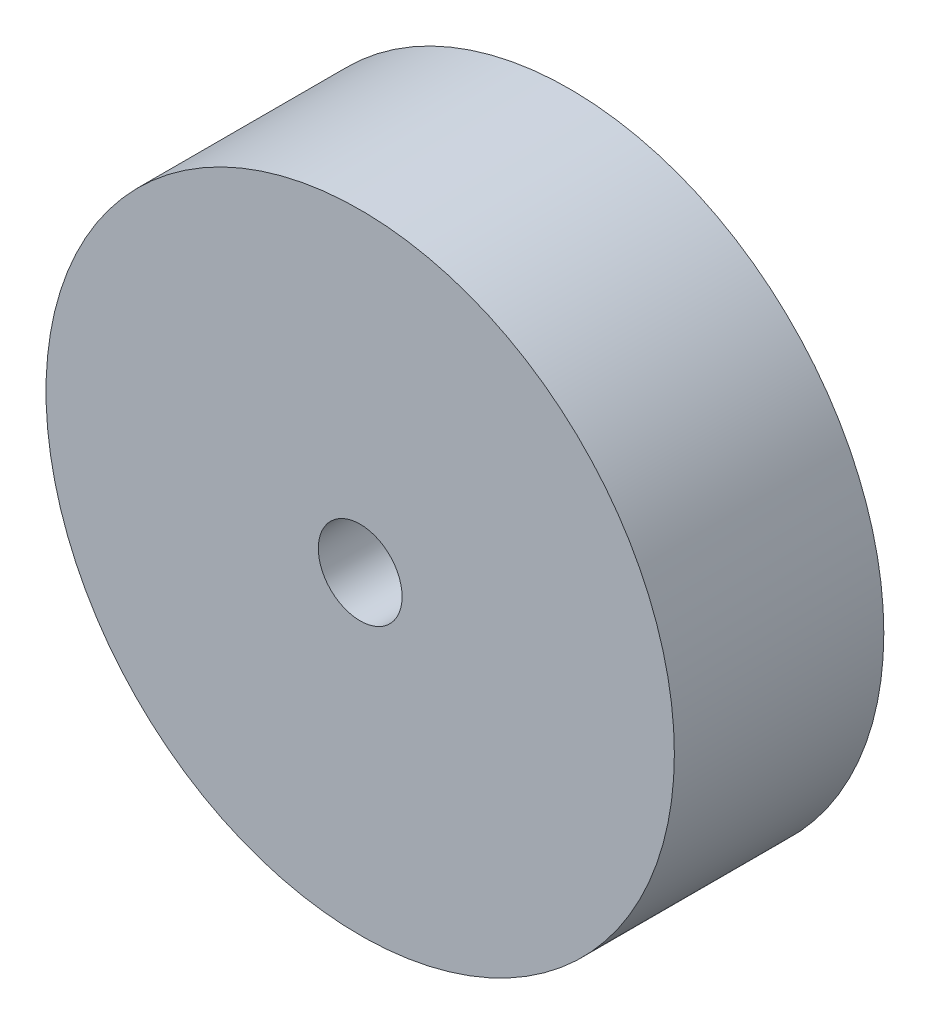
from build123d import *

# Parameters (mm, degrees)
SKETCH_1_R      = 15
SKETCH_1_R_2    = 2
EXTRUDE_1_DEPTH = 10


with BuildPart() as part:
    # 草图1 → 凸台-拉伸1 (new body)
    with BuildSketch(Plane.XY):
        Circle(SKETCH_1_R)
        Circle(SKETCH_1_R_2, mode=Mode.SUBTRACT)
    extrude(amount=EXTRUDE_1_DEPTH)


solid = part.part
